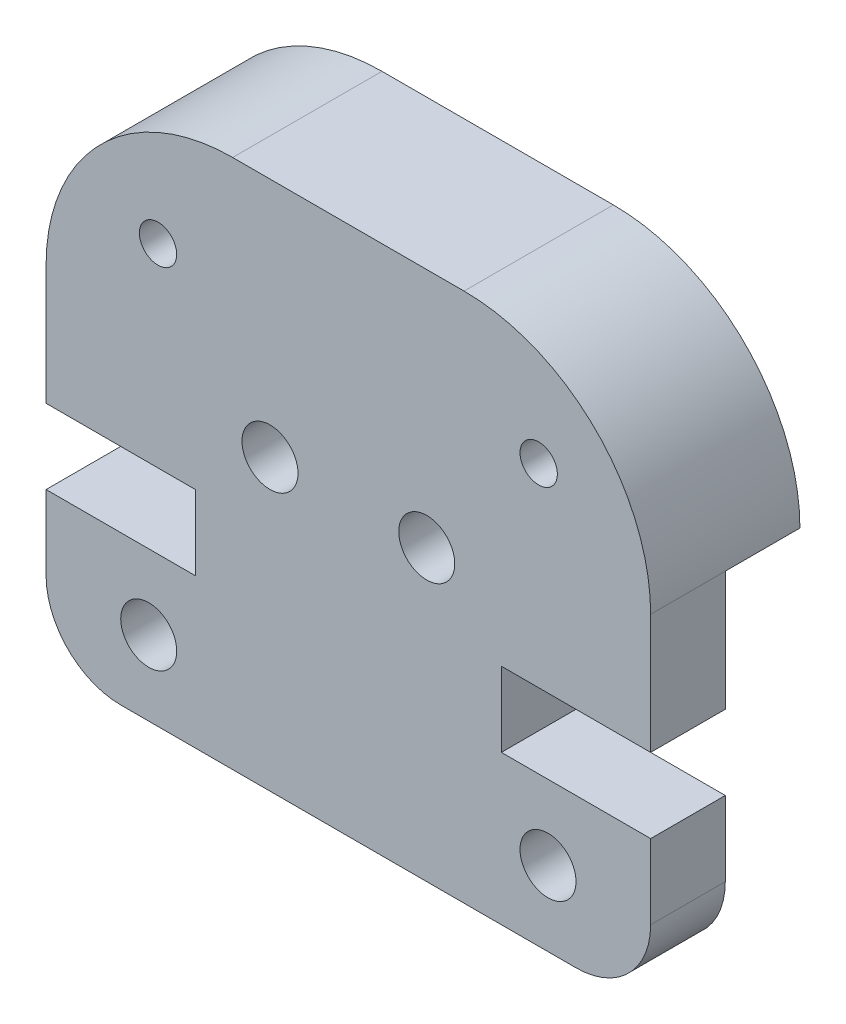
from build123d import *

# Parameters (mm, degrees)
SKETCH1_R           = 0.75
SKETCH1_R_2         = 0.5
BOSS_EXTRUDE1_DEPTH = 4
SKETCH2_W           = 16.2
SKETCH2_H           = 9.205
CUT_EXTRUDE1_DEPTH  = 2


with BuildPart() as part:
    # Sketch1 → Boss-Extrude1 (new body)
    with BuildSketch(Plane.XY):
        with BuildLine():
            Line((12.2, 4), (16.2, 4))
            Line((16.2, 4), (16.2, 2))
            ThreePointArc((16.2, 2), (15.614213562, 0.585786438), (14.2, 0))
            Line((14.2, 0), (2, 0))
            ThreePointArc((2, 0), (0.585786438, 0.585786438), (0, 2))
            Line((0, 2), (0, 4))
            Line((0, 4), (4, 4))
            Line((4, 4), (4, 6))
            Line((4, 6), (0, 6))
            Line((0, 6), (0, 9.205))
            ThreePointArc((0, 9.205), (1.464466094, 12.740533906), (5, 14.205))
            Line((5, 14.205), (11.2, 14.205))
            ThreePointArc((11.2, 14.205), (14.735533906, 12.740533906), (16.2, 9.205))
            Line((16.2, 9.205), (16.2, 6))
            Line((16.2, 6), (12.2, 6))
            Line((12.2, 6), (12.2, 4))
        make_face()
        with Locations((13.45, 2)):
            Circle(SKETCH1_R, mode=Mode.SUBTRACT)
        with Locations((13.2, 11.205)):
            Circle(SKETCH1_R_2, mode=Mode.SUBTRACT)
        with Locations((10.2, 7.75)):
            Circle(SKETCH1_R, mode=Mode.SUBTRACT)
        with Locations((6, 7.75)):
            Circle(SKETCH1_R, mode=Mode.SUBTRACT)
        with Locations((3, 11.205)):
            Circle(SKETCH1_R_2, mode=Mode.SUBTRACT)
        with Locations((2.75, 2)):
            Circle(SKETCH1_R, mode=Mode.SUBTRACT)
    extrude(amount=BOSS_EXTRUDE1_DEPTH)

    # Sketch2 → Cut-Extrude1 (cut)
    with BuildSketch(Plane(origin=(0, 0, 0), x_dir=(-1, 0, 0), z_dir=(0, 0, -1))):
        with Locations((-8.1, 4.6025)):
            Rectangle(SKETCH2_W, SKETCH2_H)
    extrude(amount=-CUT_EXTRUDE1_DEPTH, mode=Mode.SUBTRACT)


solid = part.part
